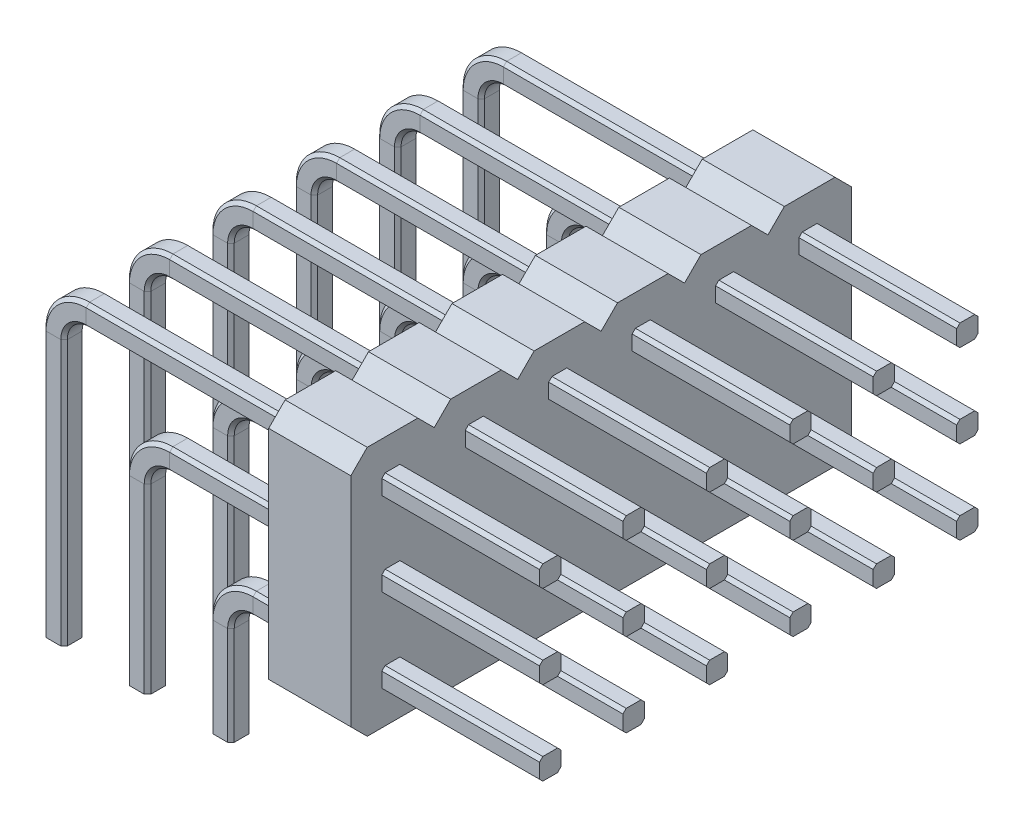
from build123d import *

# Parameters (mm, degrees)
BOSS_EXTRUDE1_DEPTH = 2.5
LPATTERN1_COUNT     = 6
LPATTERN1_PITCH     = 2.54


with BuildPart() as part:
    # Sweep1: sweep along a path in Sketch2
    with BuildLine(Plane.XY) as sweep1_path:
        Line((5.08, 0), (5.08, 3))
        ThreePointArc((5.08, 3), (5.372893219, 3.707106781), (6.08, 4))
        Line((6.08, 4), (14.8, 4))
    # Sketch1 → Sweep1 (sweep)
    with BuildSketch(Plane(origin=(0, 0, 0), x_dir=(1, 0, 0), z_dir=(0, 1, 0))):
        Polygon((4.855, -0.325), (5.305, -0.325), (5.405, -0.225), (5.405, 0.225), (5.305, 0.325), (4.855, 0.325), (4.755, 0.225), (4.755, -0.225), align=None)
    sweep(path=sweep1_path.line)



with BuildPart() as body_2:
    # Sweep2: sweep along a path in Sketch2<3>
    with BuildLine(Plane.XY) as sweep2_path:
        Line((2.54, 0), (2.54, 5.54))
        ThreePointArc((2.54, 5.54), (2.832893219, 6.247106781), (3.54, 6.54))
        Line((3.54, 6.54), (14.8, 6.54))
    # Sketch1<3> → Sweep2 (sweep)
    with BuildSketch(Plane(origin=(0, 0, 0), x_dir=(1, 0, 0), z_dir=(0, 1, 0))):
        Polygon((2.315, -0.325), (2.765, -0.325), (2.865, -0.225), (2.865, 0.225), (2.765, 0.325), (2.315, 0.325), (2.215, 0.225), (2.215, -0.225), align=None)
    sweep(path=sweep2_path.line)


with BuildPart() as body_3:
    # Sweep3: sweep along a path in Sketch2<4>
    with BuildLine(Plane.XY) as sweep3_path:
        Line((0, 0), (0, 8.08))
        ThreePointArc((0, 8.08), (0.292893219, 8.787106781), (1, 9.08))
        Line((1, 9.08), (14.8, 9.08))
    # Sketch1<4> → Sweep3 (sweep)
    with BuildSketch(Plane(origin=(0, 0, 0), x_dir=(1, 0, 0), z_dir=(0, 1, 0))):
        Polygon((-0.325, 0.225), (-0.225, 0.325), (0.225, 0.325), (0.325, 0.225), (0.325, -0.225), (0.225, -0.325), (-0.225, -0.325), (-0.325, -0.225), align=None)
    sweep(path=sweep3_path.line)


with BuildPart() as part_1:
    add(part.part)

    add(body_2.part)  # Boss-Extrude1 merges body 2

    add(body_3.part)  # Boss-Extrude1 merges body 3
    # Sketch5 → Boss-Extrude1 (add)
    with BuildSketch(Plane(origin=(7.5, 0, 0), x_dir=(0, 0, -1), z_dir=(1, 0, 0))):
        Polygon((-0.77, 10.35), (0.77, 10.35), (1.27, 9.85), (1.27, 3.23), (0.77, 2.73), (-0.77, 2.73), (-1.27, 3.23), (-1.27, 9.85), align=None)
    extrude(amount=BOSS_EXTRUDE1_DEPTH)


with BuildPart() as lpattern1_1:
    # LPattern1: pattern copy
    add(part_1.part.moved(Location(Vector(0, 0, -1) * (1 * LPATTERN1_PITCH))))


with BuildPart() as lpattern1_2:
    # LPattern1: pattern copy
    add(part_1.part.moved(Location(Vector(0, 0, -1) * (2 * LPATTERN1_PITCH))))


with BuildPart() as lpattern1_3:
    # LPattern1: pattern copy
    add(part_1.part.moved(Location(Vector(0, 0, -1) * (3 * LPATTERN1_PITCH))))


with BuildPart() as lpattern1_4:
    # LPattern1: pattern copy
    add(part_1.part.moved(Location(Vector(0, 0, -1) * (4 * LPATTERN1_PITCH))))


with BuildPart() as lpattern1_5:
    # LPattern1: pattern copy
    add(part_1.part.moved(Location(Vector(0, 0, -1) * (5 * LPATTERN1_PITCH))))


with BuildPart() as part_2:
    add(part_1.part)

    # Combine1: union LPattern1_1, LPattern1_2, LPattern1_3, LPattern1_4, LPattern1_5
    add(lpattern1_1.part)
    add(lpattern1_2.part)
    add(lpattern1_3.part)
    add(lpattern1_4.part)
    add(lpattern1_5.part)


solid = part_2.part
